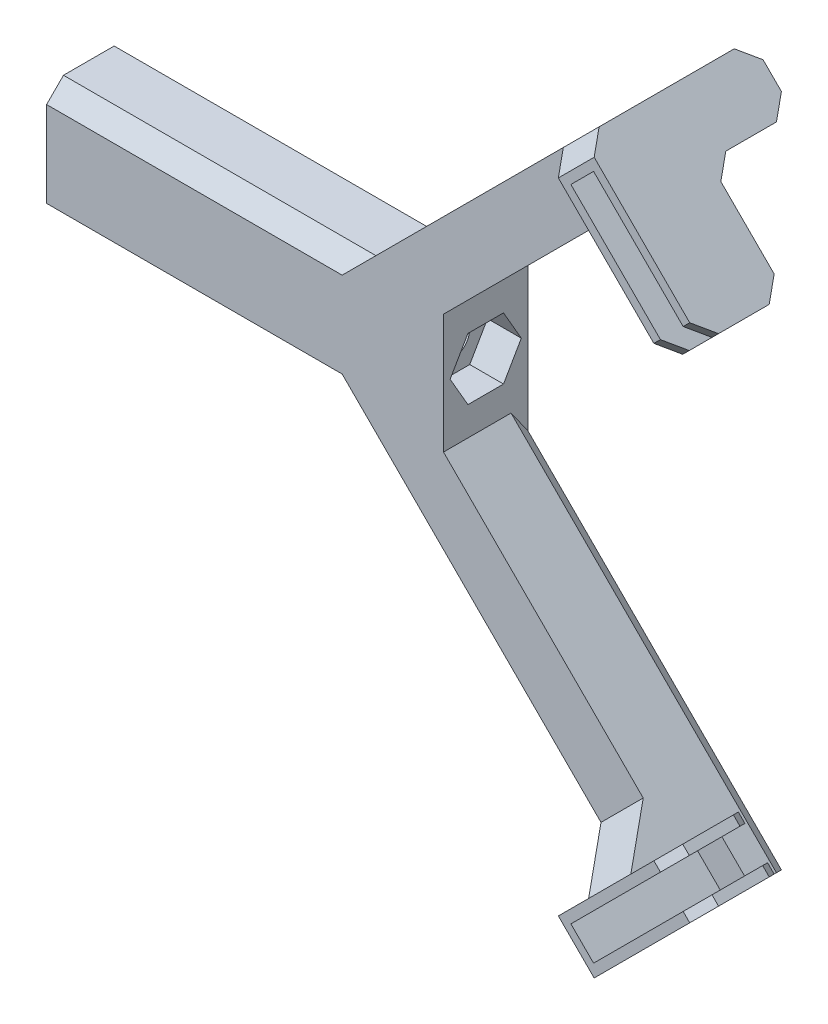
from build123d import *

# Parameters (mm, degrees)
EXTRUDE_1_DEPTH          = 5
CHAMFER_1_SIZE           = 10
CUT_EXTRUDE_1_DEPTH      = 61.279402969
CUT_EXTRUDE_1_DEPTH_BACK = 61.279402969
SKETCH_2_R               = 2.1
EXTRUDE_START            = 37
SKETCH_3_W               = 10
SKETCH_3_H               = 14.142135624
SKETCH_3_R               = 2.1
EXTRUDE_2_DEPTH          = 37
SKETCH_4_W               = 10
SKETCH_4_H               = 20
EXTRUDE_3_DEPTH          = 6
SKETCH_6_W               = 10
SKETCH_6_H               = 32
EXTRUDE_5_DEPTH          = 6
CUT_EXTRUDE_2_DEPTH      = 15
CUT_EXTRUDE_3_DEPTH      = 72.219678224
SKETCH_10_W              = 15
SKETCH_10_H              = 3.8
EXTRUDE_6_DEPTH          = 3
CHAMFER_2_SIZE           = 2
CHAMFER_3_SIZE           = 2
CHAMFER_4_SIZE           = 5
CHAMFER_5_SIZE           = 2
SKETCH_12_R              = 3.2
CUT_EXTRUDE_4_DEPTH      = 38
CUT_EXTRUDE_5_DEPTH      = 4


with BuildPart() as part:
    # 草图1 → 凸台-拉伸1 (new, symmetric)
    with BuildSketch(Plane.XY):
        Polygon((-10, 0), (33.5, 43.5), (38.5, 38.5), (0, 0), (38.5, -38.5), (33.5, -43.5), align=None)
    extrude(amount=EXTRUDE_1_DEPTH, both=True)

    # 倒角1
    chamfer_1_edges = [part.edges().sort_by_distance(p)[0] for p in [
        (-10, 0, 0),
        (0, 0, 0),
    ]]
    chamfer(chamfer_1_edges, length=CHAMFER_1_SIZE)

    # 草图2 → 切除-拉伸1 (cut, two sides: drawn at the far end of the back side and taken through both)
    with BuildSketch(Plane.ZY.offset(2.928932188).offset(-CUT_EXTRUDE_1_DEPTH_BACK)):
        with Locations(Location((0, 0, 0), (0, 0, 270))):
            Circle(SKETCH_2_R)
    extrude(amount=CUT_EXTRUDE_1_DEPTH + CUT_EXTRUDE_1_DEPTH_BACK, mode=Mode.SUBTRACT)

    # 草图3 → 凸台-拉伸2 (add)
    with BuildSketch(Plane.ZY.offset(2.928932188).offset(EXTRUDE_START)):
        Rectangle(SKETCH_3_W, SKETCH_3_H)
        with Locations(Location((0, 0, 0), (0, 0, 270))):
            Circle(SKETCH_3_R, mode=Mode.SUBTRACT)
    extrude(amount=-EXTRUDE_2_DEPTH)

    # 草图4 → 凸台-拉伸3 (add)
    with BuildSketch(Plane(origin=(38.5, 38.5, 0), x_dir=(0, 0, -1), z_dir=(0.7071067811865467, 0.7071067811865485, 0))):
        with Locations((-10, -2.928932188)):
            Rectangle(SKETCH_4_W, SKETCH_4_H)
    extrude_3 = extrude(amount=-EXTRUDE_3_DEPTH)

    # 草图6 → 凸台-拉伸5 (add)
    with BuildSketch(Plane(origin=(38.5, 38.5, 0), x_dir=(0, 0, -1), z_dir=(0.7071067811865467, 0.7071067811865485, 0))):
        with Locations((-10, 3.071067812)):
            Rectangle(SKETCH_6_W, SKETCH_6_H)
    extrude_5 = extrude(amount=-EXTRUDE_5_DEPTH)

    # 草图8 → 切除-拉伸2 (cut)
    with BuildSketch(Plane.XY.offset(15)):
        Polygon((21.549895398, 48.520458146), (44.177312396, 25.893041148), (46.864318164, 28.580046917), (24.236901166, 51.207463915), align=None)
    cut_extrude_2 = extrude(amount=-CUT_EXTRUDE_2_DEPTH, mode=Mode.SUBTRACT)

    # 草图9 → 切除-拉伸3 (cut, through all)
    with BuildSketch(Plane(origin=(0, 0, 5), x_dir=(-1, 0, 0), z_dir=(0, 0, -1))):
        Polygon((-32.722182541, 42.722182541), (-24.236901166, 51.207463915), (-25.014718626, 51.985281374), (-33.5, 43.5), align=None)
        Polygon((-21.549895398, 48.520458146), (-30.035176772, 40.035176772), (-29.257359313, 39.257359313), (-20.772077939, 47.742640687), align=None)
    cut_extrude_3 = extrude(amount=-CUT_EXTRUDE_3_DEPTH, mode=Mode.SUBTRACT)

    # 草图10 → 凸台-拉伸6 (add)
    with BuildSketch(Plane(origin=(-5, 5, 0), x_dir=(0, 0, 1), z_dir=(-0.7071067811865487, 0.7071067811865465, 0))):
        with Locations((7.5, 51.447222151)):
            Rectangle(SKETCH_10_W, SKETCH_10_H)
    extrude_6 = extrude(amount=-EXTRUDE_6_DEPTH)

    # 倒角2
    chamfer_2_edges = [part.edges().sort_by_distance(p)[0] for p in [
        (47.253226894, 28.968955647, 15),
        (31.378679656, 41.378679656, 15),
        (22.785533906, 22.785533906, -5),
        (43.788403666, 25.504132419, 5),
        (43.788403666, 25.504132419, 15),
        (15.285533906, 25.285533906, -5),
        (38.11109127, 38.11109127, 5),
        (47.253226894, 28.968955647, 5),
    ]]
    chamfer(chamfer_2_edges, length=CHAMFER_2_SIZE)

    # 镜向1: 凸台-拉伸3, 凸台-拉伸5, 切除-拉伸2, 切除-拉伸3, 凸台-拉伸6 across plane
    add(extrude_3.mirror(Plane.ZX))
    add(extrude_5.mirror(Plane.ZX))
    add(cut_extrude_2.mirror(Plane.ZX), mode=Mode.SUBTRACT)
    add(cut_extrude_3.mirror(Plane.ZX), mode=Mode.SUBTRACT)
    add(extrude_6.mirror(Plane.ZX))

    # 倒角3
    chamfer_3_edges = [part.edges().sort_by_distance(p)[0] for p in [
        (38.11109127, -38.11109127, 5),
        (15.285533906, -25.285533906, -5),
        (43.788403666, -25.504132419, 5),
        (43.788403666, -25.504132419, 15),
        (34.646268043, -34.646268043, 5),
        (47.253226894, -28.968955647, 5),
        (47.253226894, -28.968955647, 15),
        (31.378679656, -41.378679656, 15),
        (22.785533906, -22.785533906, -5),
    ]]
    chamfer(chamfer_3_edges, length=CHAMFER_3_SIZE)

    # 倒角4
    chamfer_4_edges = [part.edges().sort_by_distance(p)[0] for p in [
        (31.757359313, -36.757359313, 5),
        (31.757359313, 36.757359313, 5),
    ]]
    chamfer(chamfer_4_edges, length=CHAMFER_4_SIZE)

    # 倒角5
    chamfer_5_edges = [part.edges().sort_by_distance(p)[0] for p in [
        (-20.014718626, -7.071067812, -5),
        (-20.014718626, 7.071067812, -5),
        (-21.428932188, -7.071067812, 5),
        (-21.428932188, 7.071067812, 5),
    ]]
    chamfer(chamfer_5_edges, length=CHAMFER_5_SIZE)

    # 草图12 → 切除-拉伸4 (cut)
    with BuildSketch(Plane.ZY.offset(39.928932188)):
        with Locations(Location((0, 0, 0), (0, 0, 270))):
            Circle(SKETCH_12_R)
    extrude(amount=-CUT_EXTRUDE_4_DEPTH, mode=Mode.SUBTRACT)

    # 草图13 → 切除-拉伸5 (cut)
    with BuildSketch(Plane(origin=(7.071067812, 0, 0), x_dir=(0, 0, -1), z_dir=(1, 0, 0))):
        Polygon((2.107328483, -3.65), (4.214656965, 0), (2.107328483, 3.65), (-2.107328483, 3.65), (-4.214656965, 0), (-2.107328483, -3.65), align=None)
    extrude(amount=-CUT_EXTRUDE_5_DEPTH, mode=Mode.SUBTRACT)


solid = part.part
